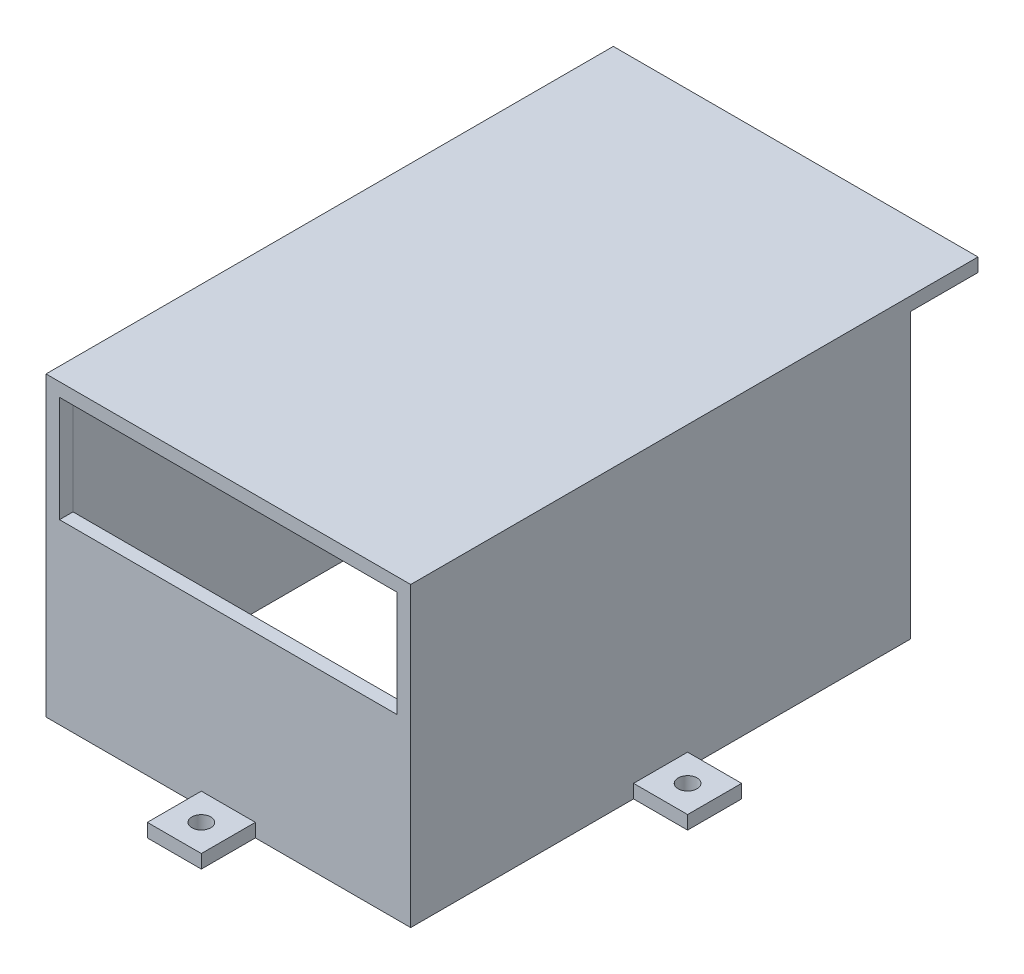
from build123d import *

# Parameters (mm, degrees)
SKETCH_1_R               = 0.7
SKETCH_1_W               = 25
SKETCH_1_H               = 35
EXTRUDE_1_DEPTH          = 1
SKETCH_3_W               = 27
SKETCH_3_H               = 37
SKETCH_3_W_2             = 25
SKETCH_3_H_2             = 35
EXTRUDE_2_DEPTH          = 20
SKETCH_4_W               = 27
SKETCH_4_H               = 37
EXTRUDE_3_DEPTH          = 1
CUT_EXTRUDE_1_DEPTH      = 37.006943775
CUT_EXTRUDE_1_DEPTH_BACK = 37.006943775
SKETCH_5_W               = 25.000009511
SKETCH_5_H               = 7.845312142
SKETCH_6_W               = 27.00004857
SKETCH_6_H               = 0.999781596
EXTRUDE_4_DEPTH          = 5


with BuildPart() as part:
    # 草图1 → 凸台-拉伸1 (new body)
    with BuildSketch(Plane(origin=(0, 0, 0), x_dir=(1, 0, 0), z_dir=(0, 1, 0))):
        Polygon((-13.5, -2), (-13.5, -18.5), (-2, -18.5), (-2, -22.5), (2, -22.5), (2, -18.5), (13.5, -18.5), (13.5, -2), (17.5, -2), (17.5, 2), (13.5, 2), (13.5, 18.5), (2, 18.5), (2, 22.5), (-2, 22.5), (-2, 18.5), (-13.5, 18.5), (-13.5, 2), (-17.5, 2), (-17.5, -2), align=None)
        with Locations(Location((-15.5, 0, 0), (0, 0, 270))):
            Circle(SKETCH_1_R, mode=Mode.SUBTRACT)
        with Locations(Location((15.5, 0, 0), (0, 0, 270))):
            Circle(SKETCH_1_R, mode=Mode.SUBTRACT)
        with Locations(Location((0, 20.5, 0), (0, 0, 270))):
            Circle(SKETCH_1_R, mode=Mode.SUBTRACT)
        with Locations(Location((0, -20.5, 0), (0, 0, 270))):
            Circle(SKETCH_1_R, mode=Mode.SUBTRACT)
        Rectangle(SKETCH_1_W, SKETCH_1_H, mode=Mode.SUBTRACT)
    extrude(amount=EXTRUDE_1_DEPTH)

    # 草图3 → 凸台-拉伸2 (add)
    with BuildSketch(Plane(origin=(0, 1, 0), x_dir=(1, 0, 0), z_dir=(0, 1, 0))):
        Rectangle(SKETCH_3_W, SKETCH_3_H)
        Rectangle(SKETCH_3_W_2, SKETCH_3_H_2, mode=Mode.SUBTRACT)
    extrude(amount=EXTRUDE_2_DEPTH)

    # 草图4 → 凸台-拉伸3 (add)
    with BuildSketch(Plane(origin=(0, 21, 0), x_dir=(1, 0, 0), z_dir=(0, 1, 0))):
        Rectangle(SKETCH_4_W, SKETCH_4_H)
    extrude(amount=EXTRUDE_3_DEPTH)

    # 草图5 → 切除-拉伸1 (cut, two sides: drawn at the far end of the back side and taken through both)
    with BuildSketch(Plane.XY.offset(-CUT_EXTRUDE_1_DEPTH_BACK)):
        with Locations((2.6183e-05, 17.077384412)):
            Rectangle(SKETCH_5_W, SKETCH_5_H)
    extrude(amount=CUT_EXTRUDE_1_DEPTH + CUT_EXTRUDE_1_DEPTH_BACK, mode=Mode.SUBTRACT)

    # 草图6 → 凸台-拉伸4 (add)
    with BuildSketch(Plane(origin=(0, 0, -18.5), x_dir=(-1, 0, 0), z_dir=(0, 0, -1))):
        with Locations((2.5906e-05, 21.500116927)):
            Rectangle(SKETCH_6_W, SKETCH_6_H)
    extrude(amount=EXTRUDE_4_DEPTH)


solid = part.part
